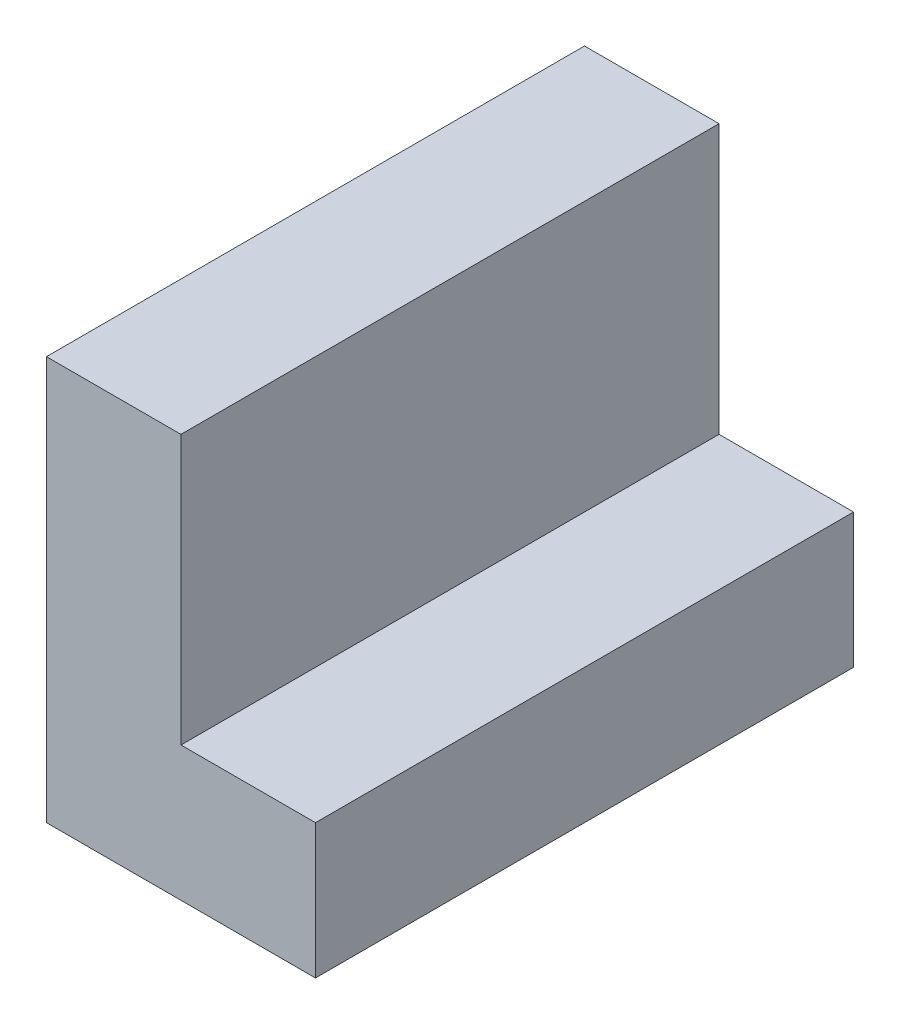
from build123d import *

# Parameters (mm, degrees)
L_BLOCK_DEPTH = 40


with BuildPart() as part:
    # Croquis1 → L block (new body)
    with BuildSketch(Plane.XY):
        Polygon((0, 0), (20, 0), (20, 10), (10, 10), (10, 30), (0, 30), align=None)
    extrude(amount=L_BLOCK_DEPTH)


solid = part.part
